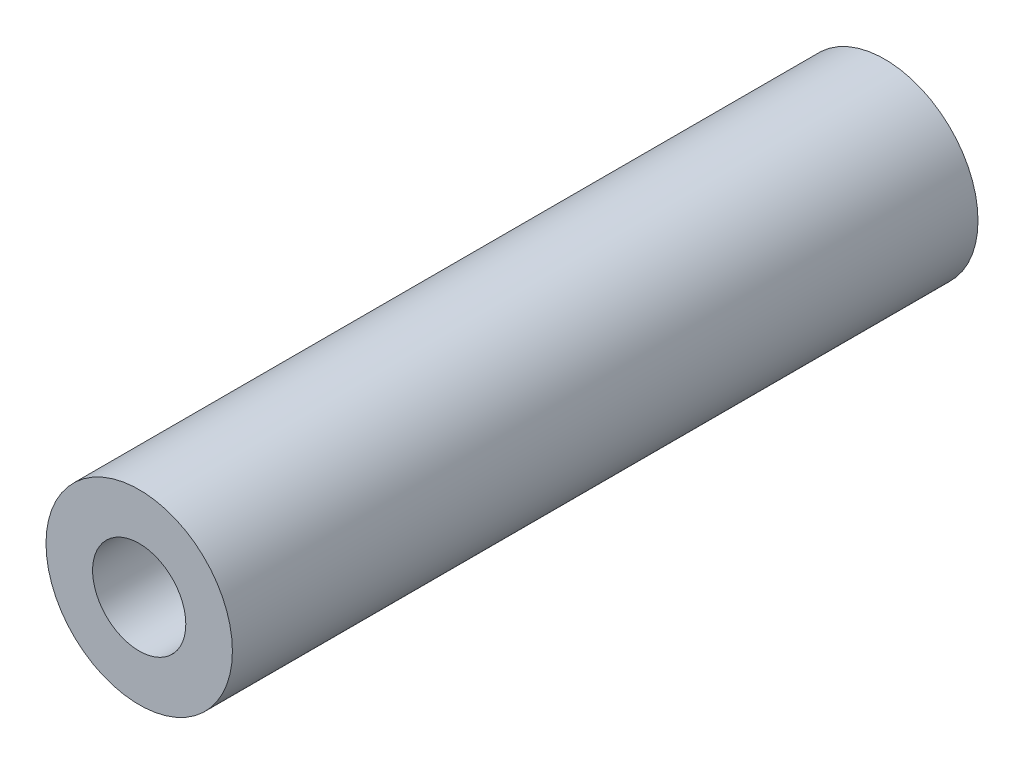
from build123d import *

# Parameters (mm, degrees)
SKETCH1_R           = 25.4
SKETCH1_R_2         = 12.7
BOSS_EXTRUDE1_DEPTH = 203.2


with BuildPart() as part:
    # Sketch1 → Boss-Extrude1 (new body)
    with BuildSketch(Plane.XY):
        Circle(SKETCH1_R)
        Circle(SKETCH1_R_2, mode=Mode.SUBTRACT)
    extrude(amount=BOSS_EXTRUDE1_DEPTH)


solid = part.part
